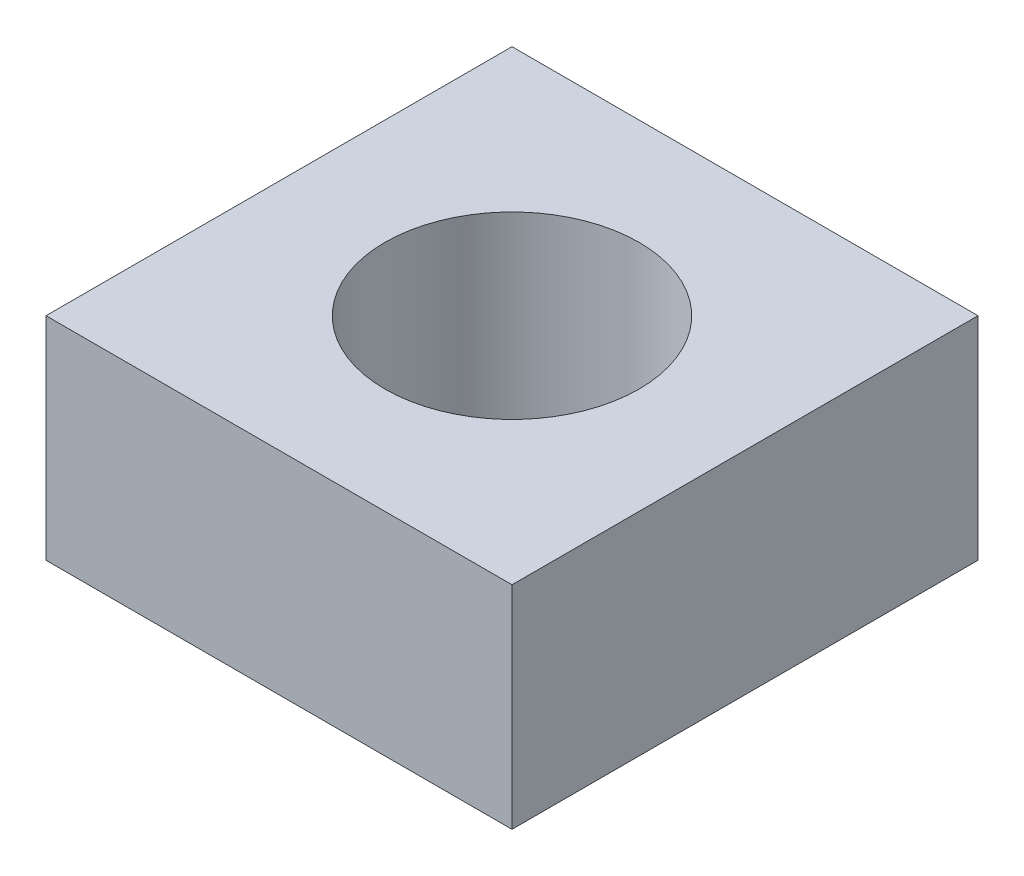
from build123d import *

# Parameters (mm, degrees)
SKETCH1_W           = 5.5
SKETCH1_H           = 5.5
SKETCH1_R           = 1.5
BOSS_EXTRUDE1_DEPTH = 2.5


with BuildPart() as part:
    # Sketch1 → Boss-Extrude1 (new body)
    with BuildSketch(Plane(origin=(0, 0, 0), x_dir=(1, 0, 0), z_dir=(0, 1, 0))):
        Rectangle(SKETCH1_W, SKETCH1_H)
        with Locations(Location((0, 0, 0), (0, 0, 270))):
            Circle(SKETCH1_R, mode=Mode.SUBTRACT)
    extrude(amount=BOSS_EXTRUDE1_DEPTH)


solid = part.part
